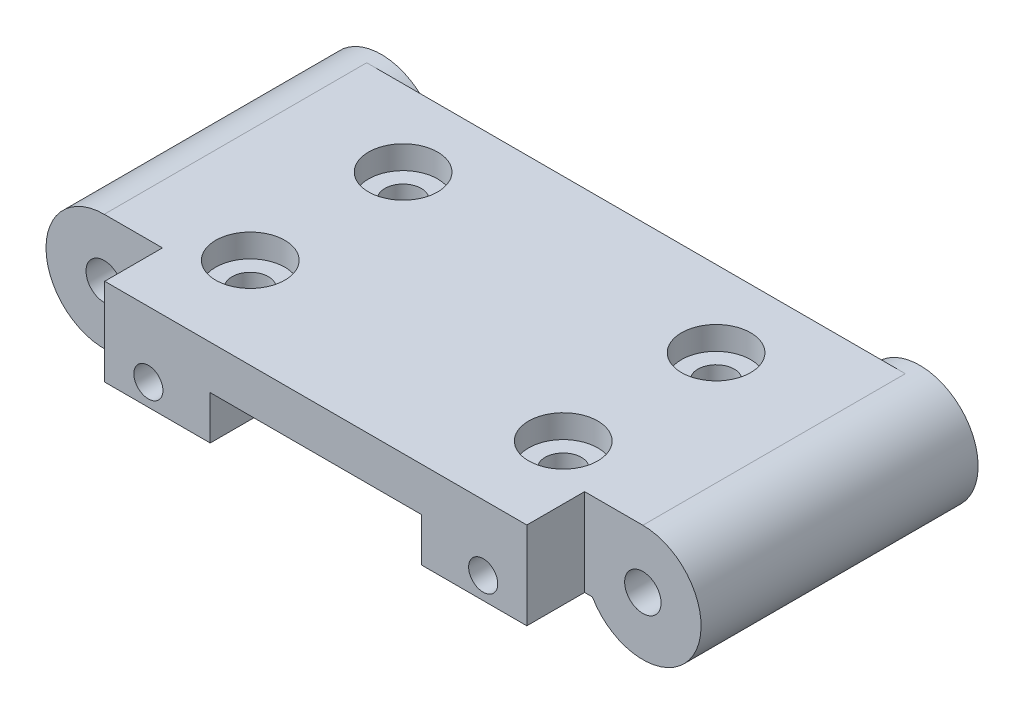
from build123d import *

# Parameters (mm, degrees)
BOSS_EXTRUDE1_DEPTH = 22
SKETCH2_W           = 8
SKETCH2_H           = 3.96875
CUT_EXTRUDE1_DEPTH  = 33.46921619
BOSS_EXTRUDE2_START = 1
SKETCH3_R           = 4
BOSS_EXTRUDE2_DEPTH = 1
SKETCH4_R           = 1.25
CUT_EXTRUDE2_DEPTH  = 33.56148031
SKETCH5_R           = 1.25
CUT_EXTRUDE3_DEPTH  = 33.46921619
CUT_EXTRUDE4_DEPTH  = 3
SKETCH7_R           = 1
CUT_EXTRUDE5_DEPTH  = 4
SKETCH8_R           = 2.375
CUT_EXTRUDE6_DEPTH  = 1.6


with BuildPart() as part:
    # Sketch1 → Boss-Extrude1 (new body)
    with BuildSketch(Plane.XY):
        with BuildLine():
            Line((18.5, 3), (-18.5, 3))
            ThreePointArc((-18.5, 3), (-21.964101615, -3), (-15.035898385, -3))
            Line((-15.035898385, -3), (15.035898385, -3))
            ThreePointArc((15.035898385, -3), (21.964101615, -3), (18.5, 3))
        make_face()
    extrude(amount=BOSS_EXTRUDE1_DEPTH)

    # Sketch2 → Cut-Extrude1 (cut, through all)
    with BuildSketch(Plane(origin=(0, 3, 0), x_dir=(1, 0, 0), z_dir=(0, 1, 0))):
        with Locations((-18.5, -20.015625)):
            Rectangle(SKETCH2_W, SKETCH2_H)
        with Locations((18.5, -20.015625)):
            Rectangle(SKETCH2_W, SKETCH2_H)
    extrude(amount=-CUT_EXTRUDE1_DEPTH, mode=Mode.SUBTRACT)

    # Sketch3 → Boss-Extrude2 (add)
    with BuildSketch(Plane(origin=(0, 0, 0), x_dir=(-1, 0, 0), z_dir=(0, 0, -1)).offset(BOSS_EXTRUDE2_START)):
        with Locations((-18.5, -1)):
            Circle(SKETCH3_R)
        with Locations((18.5, -1)):
            Circle(SKETCH3_R)
    extrude(amount=-BOSS_EXTRUDE2_DEPTH)

    # Sketch4 → Cut-Extrude2 (cut, through all)
    with BuildSketch(Plane(origin=(0, 0, -1), x_dir=(-1, 0, 0), z_dir=(0, 0, -1))):
        with Locations((-18.5, -1)):
            Circle(SKETCH4_R)
        with Locations((18.5, -1)):
            Circle(SKETCH4_R)
    extrude(amount=-CUT_EXTRUDE2_DEPTH, mode=Mode.SUBTRACT)

    # Sketch5 → Cut-Extrude3 (cut, through all)
    with BuildSketch(Plane(origin=(0, 3, 0), x_dir=(1, 0, 0), z_dir=(0, 1, 0))):
        with Locations((-10.75, -5.25)):
            Circle(SKETCH5_R)
        with Locations((10.75, -5.25)):
            Circle(SKETCH5_R)
        with Locations((10.75, -15.75)):
            Circle(SKETCH5_R)
        with Locations((-10.75, -15.75)):
            Circle(SKETCH5_R)
    extrude(amount=-CUT_EXTRUDE3_DEPTH, mode=Mode.SUBTRACT)

    # Sketch6 → Cut-Extrude4 (cut)
    with BuildSketch(Plane.XZ.offset(3)):
        with BuildLine():
            Line((-6.852885683, 2), (6.852885683, 2))
            ThreePointArc((6.852885683, 2), (7.718911087, 2.5), (7.718911087, 3.5))
            ThreePointArc((7.718911087, 3.5), (8.275126266, 7.724873734), (12.5, 8.281088913))
            ThreePointArc((12.5, 8.281088913), (13.5, 8.281088913), (14, 9.147114317))
            Line((14, 9.147114317), (14, 11.852885683))
            ThreePointArc((14, 11.852885683), (13.5, 12.718911087), (12.5, 12.718911087))
            ThreePointArc((12.5, 12.718911087), (9, 12.718911087), (7.25, 15.75))
            Line((7.25, 15.75), (7.25, 22))
            Line((7.25, 22), (-7.25, 22))
            Line((-7.25, 22), (-7.25, 15.75))
            ThreePointArc((-7.25, 15.75), (-9, 12.718911087), (-12.5, 12.718911087))
            ThreePointArc((-12.5, 12.718911087), (-13.5, 12.718911087), (-14, 11.852885683))
            Line((-14, 11.852885683), (-14, 9.147114317))
            ThreePointArc((-14, 9.147114317), (-13.5, 8.281088913), (-12.5, 8.281088913))
            ThreePointArc((-12.5, 8.281088913), (-8.275126266, 7.724873734), (-7.718911087, 3.5))
            ThreePointArc((-7.718911087, 3.5), (-7.718911087, 2.5), (-6.852885683, 2))
        make_face()
    extrude(amount=-CUT_EXTRUDE4_DEPTH, mode=Mode.SUBTRACT)

    # Sketch7 → Cut-Extrude5 (cut)
    with BuildSketch(Plane.XY.offset(22)):
        with Locations((-11.5, -1.5)):
            Circle(SKETCH7_R)
        with Locations((11.5, -1.5)):
            Circle(SKETCH7_R)
    extrude(amount=-CUT_EXTRUDE5_DEPTH, mode=Mode.SUBTRACT)

    # Sketch8 → Cut-Extrude6 (cut)
    with BuildSketch(Plane(origin=(0, 3, 0), x_dir=(1, 0, 0), z_dir=(0, 1, 0))):
        with Locations((-10.75, -5.25)):
            Circle(SKETCH8_R)
        with Locations((10.75, -5.25)):
            Circle(SKETCH8_R)
        with Locations((10.75, -15.75)):
            Circle(SKETCH8_R)
        with Locations((-10.75, -15.75)):
            Circle(SKETCH8_R)
    extrude(amount=-CUT_EXTRUDE6_DEPTH, mode=Mode.SUBTRACT)


solid = part.part
